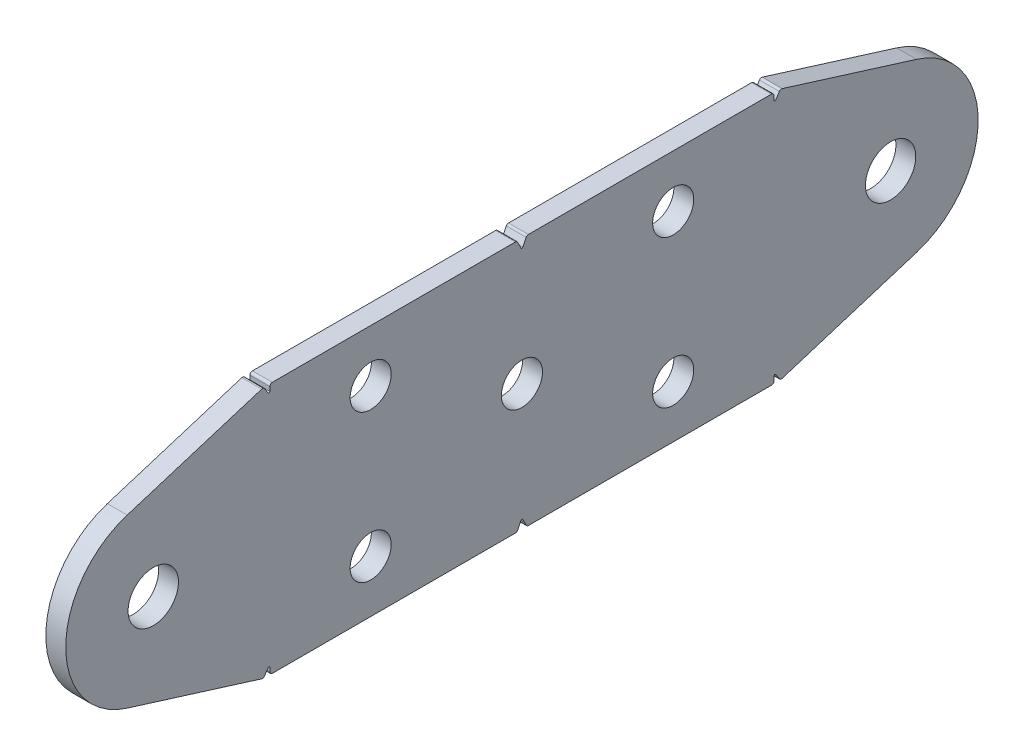
from build123d import *

# Parameters (mm, degrees)
SKETCH1_R               = 2.07
SKETCH1_R_2             = 2.5375
BOSS_EXTRUDE1_DEPTH     = 1
CUT_EXTRUDE1_DEPTH      = 48.733959609
CUT_EXTRUDE1_DEPTH_BACK = 48.733959609
FILLET1_R               = 0.250000008


with BuildPart() as part:
    # Sketch1 → Boss-Extrude1 (new, symmetric)
    with BuildSketch(Plane(origin=(0, 0, 0), x_dir=(0, 0, -1), z_dir=(1, 0, 0))):
        with BuildLine():
            Line((-26.035, 12.7), (26.035, 12.7))
            Line((26.035, 12.7), (39.770143518, 8.423671838))
            ThreePointArc((39.770143518, 8.423671838), (45.97, 0), (39.770143518, -8.423671838))
            Line((39.770143518, -8.423671838), (26.035, -12.7))
            Line((26.035, -12.7), (-26.035, -12.7))
            Line((-26.035, -12.7), (-39.770143518, -8.423671838))
            ThreePointArc((-39.770143518, -8.423671838), (-45.97, 0), (-39.770143518, 8.423671838))
            Line((-39.770143518, 8.423671838), (-26.035, 12.7))
        make_face()
        Circle(SKETCH1_R, mode=Mode.SUBTRACT)
        with Locations((-15.24, 7.434146341)):
            Circle(SKETCH1_R, mode=Mode.SUBTRACT)
        with Locations((-15.24, -7.434146341)):
            Circle(SKETCH1_R, mode=Mode.SUBTRACT)
        with Locations(Location((15.24, -7.434146341, 0), (0, 0, 180))):
            Circle(SKETCH1_R, mode=Mode.SUBTRACT)
        with Locations(Location((15.24, 7.434146341, 0), (0, 0, 180))):
            Circle(SKETCH1_R, mode=Mode.SUBTRACT)
        with Locations((-37.1475, 0)):
            Circle(SKETCH1_R_2, mode=Mode.SUBTRACT)
        with Locations(Location((37.1475, 0, 0), (0, 0, 180))):
            Circle(SKETCH1_R_2, mode=Mode.SUBTRACT)
    extrude(amount=BOSS_EXTRUDE1_DEPTH, both=True)

    # Sketch2 → Cut-Extrude1 (cut, two sides: drawn at the far end of the back side and taken through both)
    with BuildSketch(Plane(origin=(1, 0, 0), x_dir=(0, 0, -1), z_dir=(1, 0, 0)).offset(-CUT_EXTRUDE1_DEPTH_BACK)):
        with BuildLine():
            Line((-25.4, 12.7), (-25.4, 12.044028029))
            ThreePointArc((-25.4, 12.044028029), (-25.472087861, 11.948002447), (-25.58441825, 11.99042244))
            Line((-25.58441825, 11.99042244), (-26.035, 12.7))
            Line((-26.035, 12.7), (-25.4, 12.7))
        make_face()
        with BuildLine():
            Line((25.4, 12.7), (25.4, 12.044028029))
            ThreePointArc((25.4, 12.044028029), (25.472087861, 11.948002447), (25.58441825, 11.99042244))
            Line((25.58441825, 11.99042244), (26.035, 12.7))
            Line((26.035, 12.7), (25.4, 12.7))
        make_face()
        with BuildLine():
            Line((25.4, -12.7), (26.035, -12.7))
            Line((26.035, -12.7), (25.58441825, -11.99042244))
            ThreePointArc((25.58441825, -11.99042244), (25.472087861, -11.948002447), (25.4, -12.044028029))
            Line((25.4, -12.044028029), (25.4, -12.7))
        make_face()
        with BuildLine():
            Line((-25.4, -12.7), (-25.4, -12.044028029))
            ThreePointArc((-25.4, -12.044028029), (-25.472087861, -11.948002447), (-25.58441825, -11.99042244))
            Line((-25.58441825, -11.99042244), (-26.035, -12.7))
            Line((-26.035, -12.7), (-25.4, -12.7))
        make_face()
        with BuildLine():
            Line((-0.5, 12.7), (0.5, 12.7))
            Line((0.5, 12.7), (0.089442719, 11.878885438))
            ThreePointArc((0.089442719, 11.878885438), (0, 11.823606798), (-0.089442719, 11.878885438))
            Line((-0.089442719, 11.878885438), (-0.5, 12.7))
        make_face()
        with BuildLine():
            Line((-0.5, -12.7), (0.5, -12.7))
            Line((0.5, -12.7), (0.089442719, -11.878885438))
            ThreePointArc((0.089442719, -11.878885438), (0, -11.823606798), (-0.089442719, -11.878885438))
            Line((-0.089442719, -11.878885438), (-0.5, -12.7))
        make_face()
    extrude(amount=CUT_EXTRUDE1_DEPTH + CUT_EXTRUDE1_DEPTH_BACK, mode=Mode.SUBTRACT)

    # Fillet1
    fillet1_edges = [part.edges().sort_by_distance(p)[0] for p in [
        (0, -12.7, -0.5),
        (0, -12.7, 0.5),
        (0, 12.7, 0.5),
        (0, 12.7, -0.5),
        (0, 12.7, 25.4),
        (0, -12.7, -26.035),
        (0, -12.7, 26.035),
        (0, 12.7, 26.035),
        (0, 12.7, -26.035),
        (0, 12.7, -25.4),
        (0, -12.7, -25.4),
        (0, -12.7, 25.4),
    ]]
    fillet(fillet1_edges, radius=FILLET1_R)


solid = part.part
